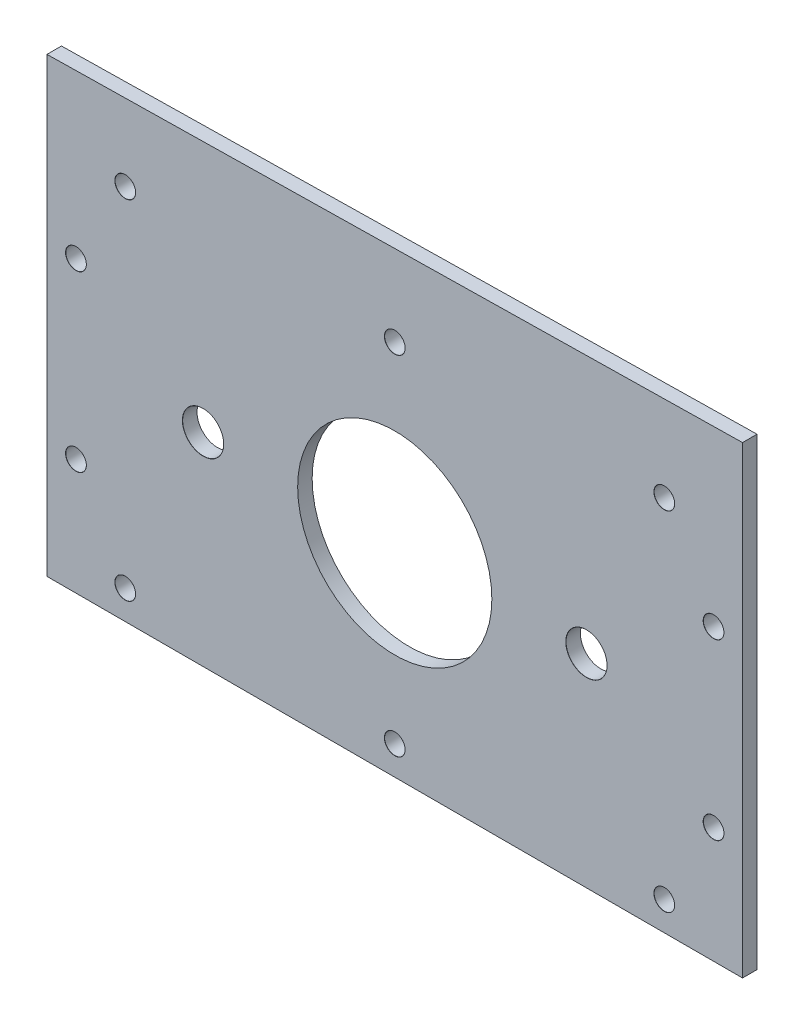
from build123d import *

# Parameters (mm, degrees)
BOSS_EXTRUDE1_DEPTH            = 3.175
M4_CLEARANCE_HOLE1_D           = 4.5
M4_CLEARANCE_HOLE1_CSINK_D     = 4.55
M4_CLEARANCE_HOLE1_CSINK_ANGLE = 90
M8_CLEARANCE_HOLE1_AT_2_COUNT  = 2
M8_CLEARANCE_HOLE1_AT_2_PITCH  = 84
SKETCH9_R                      = 21.275
CENTER_HOLE_DEPTH              = 96.302901976


with BuildPart() as part:
    # Sketch1 → Boss-Extrude1 (new body)
    with BuildSketch(Plane.XY):
        Polygon((-76.2, 54.61), (-76.2, 44.45), (-76.2, -44.45), (76.2, -44.45), (76.2, 44.45), (76.2, 57.15), align=None)
    extrude(amount=BOSS_EXTRUDE1_DEPTH)

    # M4 Clearance Hole1 (through all)
    with Locations(Plane.XY.offset(3.175)):
        with Locations((-69.85, 19.05), (-59.055, 38.1), (0, 38.1), (59.055, 38.1), (69.85, 19.05), (69.85, -19.05), (59.055, -38.1), (0, -38.1), (-59.055, -38.1), (-69.85, -19.05)):
            CounterSinkHole(M4_CLEARANCE_HOLE1_D / 2, M4_CLEARANCE_HOLE1_CSINK_D / 2, counter_sink_angle=M4_CLEARANCE_HOLE1_CSINK_ANGLE)

    # Sketch11 → M8 Clearance Hole1 (revolve, cut)
    with BuildSketch(Plane(origin=(-42, 0, 3.175), x_dir=(0, -1, 0), z_dir=(1, 0, 0))):
        Polygon((0, 0), (0, 3.175), (4.5, 3.175), (4.5, 0.025), (4.525, 0), align=None)
    m8_clearance_hole1 = revolve(axis=Axis((-42, 0, 9.525), (0, 0, -1)), mode=Mode.SUBTRACT)

    # M8 Clearance Hole1 at 2: M8 Clearance Hole1 ×2
    with Locations(*[(i * M8_CLEARANCE_HOLE1_AT_2_PITCH, 0, 0) for i in range(1, M8_CLEARANCE_HOLE1_AT_2_COUNT)]):
        add(m8_clearance_hole1, mode=Mode.SUBTRACT)

    # Sketch9 → Center Hole (cut, through all)
    with BuildSketch(Plane.XY.offset(3.175)):
        Circle(SKETCH9_R)
    extrude(amount=-CENTER_HOLE_DEPTH, mode=Mode.SUBTRACT)


solid = part.part
